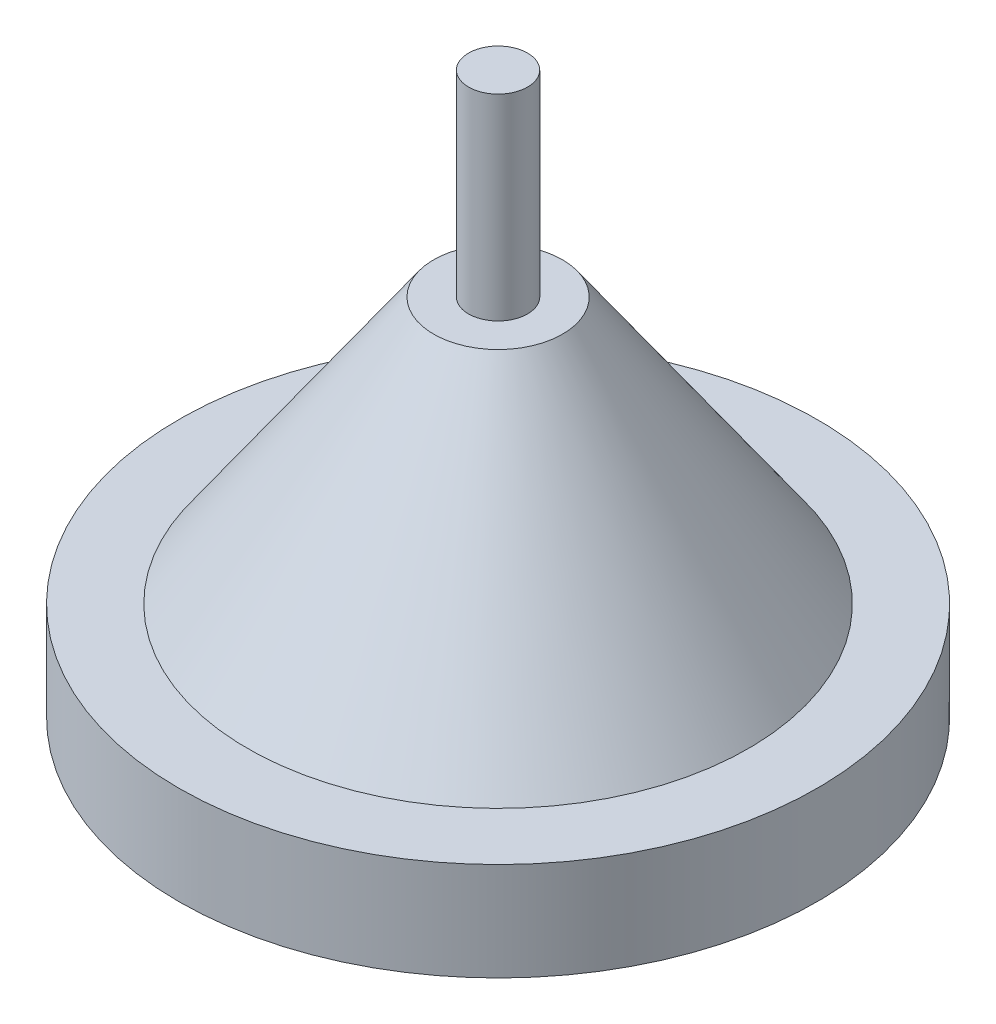
from build123d import *

# Parameters (mm, degrees)
SKETCH_2_R      = 6.56
SKETCH_1_R      = 25.5
SKETCH_3_R      = 32.5
EXTRUDE_1_DEPTH = 10
SKETCH_4_R      = 3
EXTRUDE_2_DEPTH = 20


with BuildPart() as part:
    # 스케치2 → 로프트1 section 0
    with BuildSketch(Plane(origin=(0, 27.05, 0), x_dir=(1, 0, 0), z_dir=(0, 1, 0))):
        Circle(SKETCH_2_R)
    # 스케치1 → 로프트1 section 1
    with BuildSketch(Plane(origin=(0, 0, 0), x_dir=(1, 0, 0), z_dir=(0, 1, 0))):
        Circle(SKETCH_1_R)
    loft()

    # 스케치3 → 보스-돌출1 (add)
    with BuildSketch(Plane(origin=(0, 0, 0), x_dir=(1, 0, 0), z_dir=(0, 1, 0))):
        with Locations(Location((0, 0, 0), (0, 0, 270))):
            Circle(SKETCH_3_R)
    extrude(amount=-EXTRUDE_1_DEPTH)

    # 스케치4 → 보스-돌출2 (add)
    with BuildSketch(Plane(origin=(0, 27.05, 0), x_dir=(1, 0, 0), z_dir=(0, 1, 0))):
        with Locations(Location((0, 0, 0), (0, 0, 270))):
            Circle(SKETCH_4_R)
    extrude(amount=EXTRUDE_2_DEPTH)


solid = part.part
